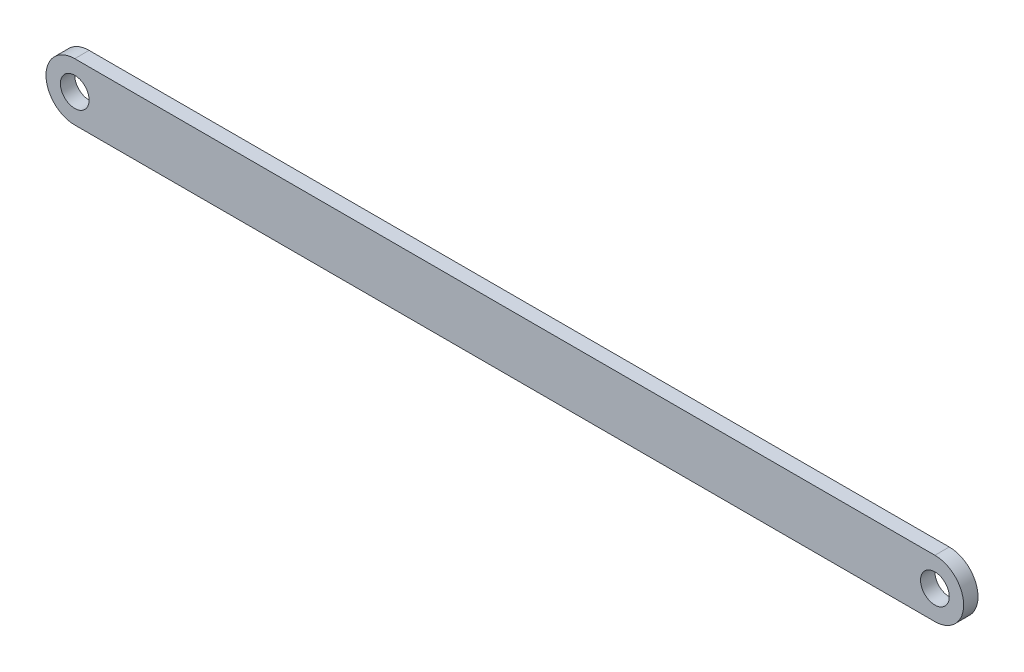
from build123d import *

# Parameters (mm, degrees)
ESBO_O1_R                = 1
RESSALTO_EXTRUS_O1_DEPTH = 1


with BuildPart() as part:
    # Esboço1 → Ressalto-extrusão1 (new body)
    with BuildSketch(Plane.XY):
        with BuildLine():
            Line((-29.935, 2), (29.935, 2))
            ThreePointArc((29.935, 2), (31.935, 0), (29.935, -2))
            Line((29.935, -2), (-29.935, -2))
            ThreePointArc((-29.935, -2), (-31.935, 0), (-29.935, 2))
        make_face()
        with Locations((-29.935, 0)):
            Circle(ESBO_O1_R, mode=Mode.SUBTRACT)
        with Locations((29.935, 0)):
            Circle(ESBO_O1_R, mode=Mode.SUBTRACT)
    extrude(amount=RESSALTO_EXTRUS_O1_DEPTH)


solid = part.part
